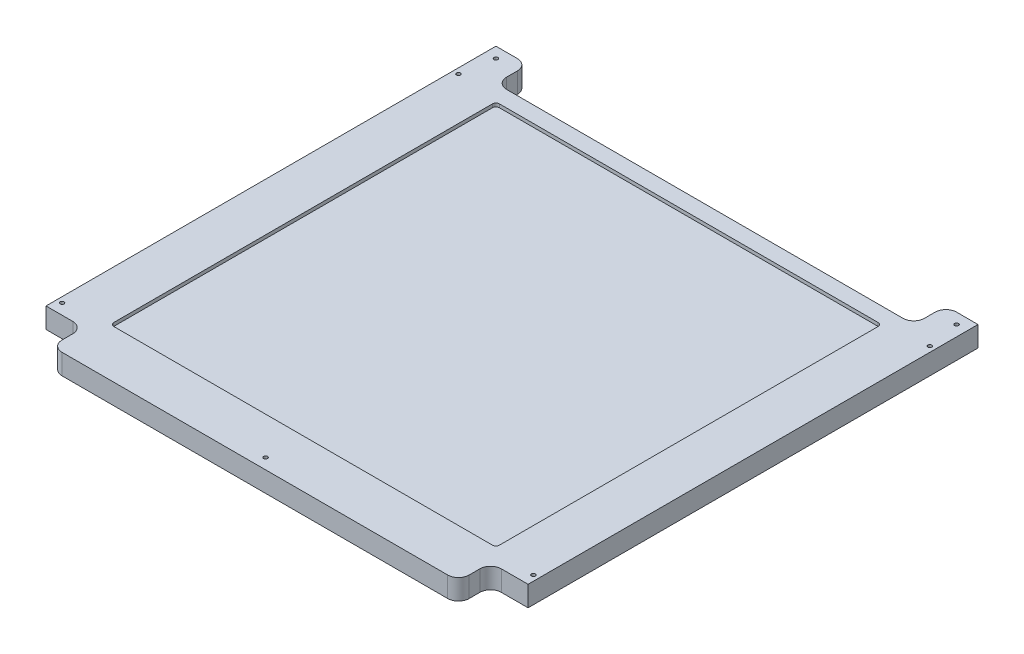
from build123d import *

# Parameters (mm, degrees)
SKETCH2_W            = 450
SKETCH2_H            = 450
BOSS_EXTRUDE1_DEPTH  = 19.05
SKETCH7_W            = 35
SKETCH7_H            = 30
SKETCH7_W_2          = 390
CUT_EXTRUDE2_DEPTH   = 637.681162357
FILLET2_R            = 10
SKETCH3_W            = 360
SKETCH3_H            = 360
CUT_EXTRUDE1_DEPTH   = 3.175
FILLET1_R            = 3.175
M3_CLEARANCE_HOLE1_D = 3.6
M3_CLEARANCE_HOLE2_D = 3.6


with BuildPart() as part:
    # Sketch2 → Boss-Extrude1 (new body)
    with BuildSketch(Plane(origin=(0, 0, 0), x_dir=(1, 0, 0), z_dir=(0, 1, 0))):
        with Locations((225, 225)):
            Rectangle(SKETCH2_W, SKETCH2_H)
    extrude(amount=BOSS_EXTRUDE1_DEPTH)

    # Sketch7 → Cut-Extrude2 (cut, through all)
    with BuildSketch(Plane(origin=(0, 19.05, 0), x_dir=(1, 0, 0), z_dir=(0, 1, 0))):
        with Locations((432.5, 15)):
            Rectangle(SKETCH7_W, SKETCH7_H)
        with Locations((17.5, 15)):
            Rectangle(SKETCH7_W, SKETCH7_H)
        with Locations((225, 435)):
            Rectangle(SKETCH7_W_2, SKETCH7_H)
    extrude(amount=-CUT_EXTRUDE2_DEPTH, mode=Mode.SUBTRACT)

    # Fillet2
    fillet2_edges = [part.edges().sort_by_distance(p)[0] for p in [
        (35, 9.525, -30),
        (35, 9.525, 0),
        (30, 9.525, -420),
        (30, 9.525, -450),
        (420, 9.525, -450),
        (420, 9.525, -420),
        (415, 9.525, 0),
        (415, 9.525, -30),
    ]]
    fillet(fillet2_edges, radius=FILLET2_R)

    # Sketch3 → Cut-Extrude1 (cut)
    with BuildSketch(Plane(origin=(0, 19.05, 0), x_dir=(1, 0, 0), z_dir=(0, 1, 0))):
        with Locations((225, 225)):
            Rectangle(SKETCH3_W, SKETCH3_H)
    extrude(amount=-CUT_EXTRUDE1_DEPTH, mode=Mode.SUBTRACT)

    # Fillet1
    fillet1_edges = [part.edges().sort_by_distance(p)[0] for p in [
        (45, 17.4625, -405),
        (405, 17.4625, -405),
        (405, 17.4625, -45),
        (45, 17.4625, -45),
    ]]
    fillet(fillet1_edges, radius=FILLET1_R)

    # M3 Clearance Hole1 (through all)
    with Locations(Plane(origin=(440, 19.05, -440), x_dir=(0, 0, 1), z_dir=(0, 1, 0))):
        with Locations((0, 0), (0, -430), (430, -215)):
            Hole(M3_CLEARANCE_HOLE1_D / 2)

    # M3 Clearance Hole2 (through all)
    with Locations(Plane(origin=(445, 19.05, -410), x_dir=(0, 0, 1), z_dir=(0, 1, 0))):
        with Locations((0, 0), (0, -440), (370, -440), (370, 0)):
            Hole(M3_CLEARANCE_HOLE2_D / 2)


solid = part.part
